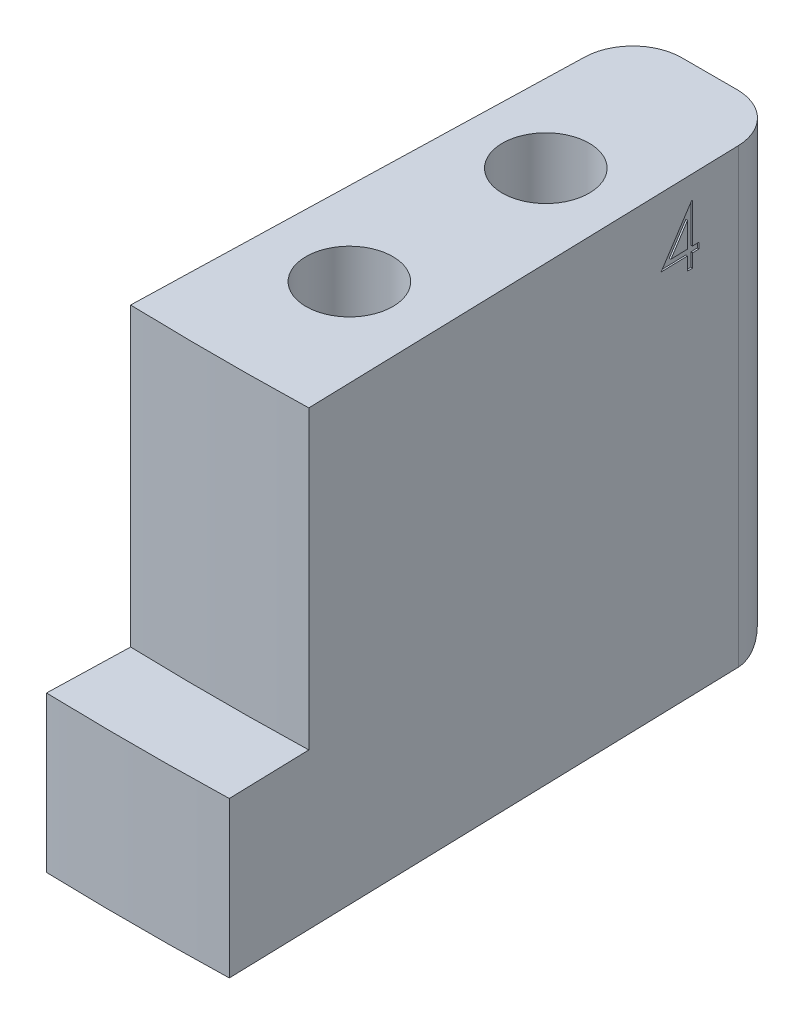
from build123d import *

# Parameters (mm, degrees)
EXTRUDE_590_DEPTH   = 27.6
EXTRUDE_638_DEPTH   = 9.5
FILLET_1_R          = 3
HOLE_WIZARD_M5_1_D  = 5.3
CUT_EXTRUDE_1_DEPTH = 5
CUT_EXTRUDE_2_DEPTH = 0.1


with BuildPart() as part:
    # 草图1 → Extrude 590 (new body)
    with BuildSketch(Plane(origin=(0, 0, 0), x_dir=(1, 0, 0), z_dir=(0, 1, 0))):
        with BuildLine():
            Line((4.608867317, -165), (-4.608867317, -165))
            Line((-4.608867317, -165), (-5.444719551, -194.923972433))
            ThreePointArc((-5.444719551, -194.923972433), (0, -195), (5.444719551, -194.923972433))
            Line((5.444719551, -194.923972433), (4.608867317, -165))
        make_face()
    extrude(amount=EXTRUDE_590_DEPTH)

    # 草图1<3> → Extrude 638 (add)
    with BuildSketch(Plane(origin=(0, 0, 0), x_dir=(1, 0, 0), z_dir=(0, 1, 0))):
        with BuildLine():
            ThreePointArc((5.444719551, -194.923972433), (0, -195), (-5.444719551, -194.923972433))
            Line((-5.444719551, -194.923972433), (-5.584327745, -199.922023008))
            ThreePointArc((-5.584327745, -199.922023008), (0, -200), (5.584327745, -199.922023008))
            Line((5.584327745, -199.922023008), (5.444719551, -194.923972433))
        make_face()
    extrude(amount=EXTRUDE_638_DEPTH)

    # 圆角1
    fillet_1_edges = [part.edges().sort_by_distance(p)[0] for p in [
        (0, 0, 165),
        (-4.608867317, 13.8, 165),
        (4.608867317, 13.8, 165),
    ]]
    fillet(fillet_1_edges, radius=FILLET_1_R)

    # M5 间隙孔1 (through all)
    with Locations(Plane(origin=(0, 27.6, 0), x_dir=(1, 0, 0), z_dir=(0, 1, 0))):
        with Locations((0, -187), (0, -175)):
            Hole(HOLE_WIZARD_M5_1_D / 2)

    # 草图6 → 切除-拉伸1 (cut)
    with BuildSketch(Plane.XZ):
        Polygon((0, 179.792007234), (-4.15, 177.396003617), (-4.15, 172.603996383), (0, 170.207992766), (4.15, 172.603996383), (4.15, 177.396003617), align=None)
        Polygon((0, 191.792007234), (-4.15, 189.396003617), (-4.15, 184.603996383), (0, 182.207992766), (4.15, 184.603996383), (4.15, 189.396003617), align=None)
    extrude(amount=-CUT_EXTRUDE_1_DEPTH, mode=Mode.SUBTRACT)

    # 草图7 → 切除-拉伸2 (cut)
    with BuildSketch(Plane(origin=(0, 0, 0), x_dir=(-0.02792163872356911, 0, -0.9996101150403545), z_dir=(0.9996101150403545, 0, -0.02792163872356911))):
        Polygon((-170.936556358, 26.18974359), (-170.872754274, 26.18974359), (-170.872754274, 23.766666667), (-170.46890812, 23.766666667), (-170.46890812, 23.407692308), (-170.872754274, 23.407692308), (-170.872754274, 22.6), (-171.186856838, 22.6), (-171.186856838, 23.407692308), (-172.847113249, 23.407692308), align=None)
        Polygon((-171.186856838, 23.766666667), (-171.186856838, 25.286698718), (-172.230126069, 23.766666667), align=None, mode=Mode.SUBTRACT)
    extrude(amount=-CUT_EXTRUDE_2_DEPTH, mode=Mode.SUBTRACT)


solid = part.part
